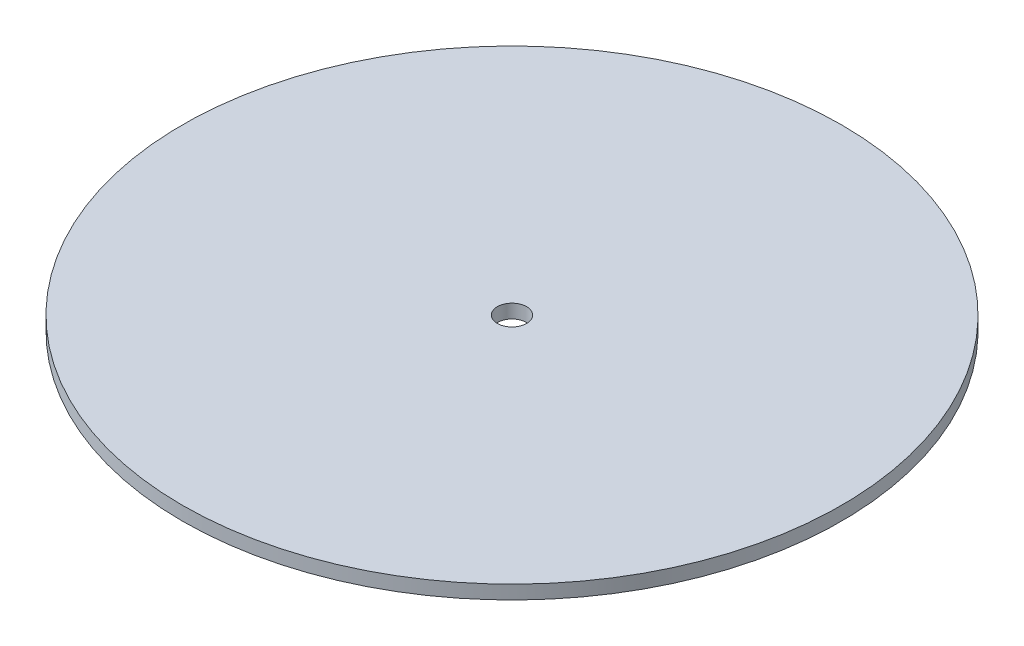
from build123d import *

# Parameters (mm, degrees)
SKETCH1_R               = 76.2
BOSS_EXTRUDE1_DEPTH     = 3.175
F_1_4_CLEARANCE_HOLE1_D = 6.7564


with BuildPart() as part:
    # Sketch1 → Boss-Extrude1 (new body)
    with BuildSketch(Plane(origin=(0, 0, 0), x_dir=(1, 0, 0), z_dir=(0, 1, 0))):
        with Locations(Location((0, 0, 0), (0, 0, 270))):
            Circle(SKETCH1_R)
    extrude(amount=BOSS_EXTRUDE1_DEPTH)

    # 1/4 Clearance Hole1 (through all)
    with Locations(Plane(origin=(0, 3.175, 0), x_dir=(1, 0, 0), z_dir=(0, 1, 0))):
        with Locations((0, 0)):
            Hole(F_1_4_CLEARANCE_HOLE1_D / 2)


solid = part.part
